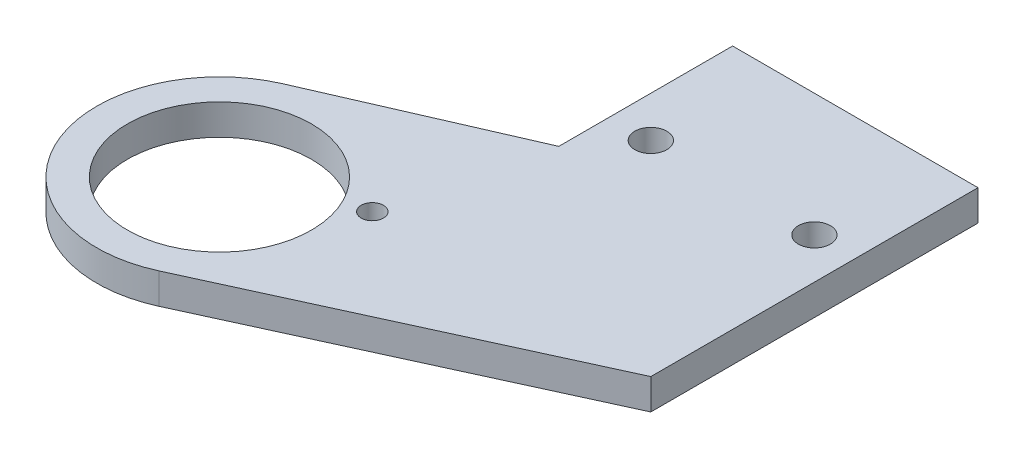
from build123d import *

# Parameters (mm, degrees)
SKETCH2_R                 = 14.2875
BOSS_EXTRUDE1_DEPTH       = 4.7625
TAP_DRILL_FOR_8_32_TAP1_D = 3.4544
F_10_CLEARANCE_HOLE1_D    = 4.9784


with BuildPart() as part:
    # Sketch2 → Boss-Extrude1 (new body)
    with BuildSketch(Plane(origin=(0, 0, 0), x_dir=(1, 0, 0), z_dir=(0, 1, 0))):
        with BuildLine():
            Line((19.05, 0), (-19.05, 0))
            Line((-19.05, 0), (-19.05, -26.9875))
            Line((-19.05, -26.9875), (-48.883968147, -39.985679272))
            ThreePointArc((-48.883968147, -39.985679272), (-58.667673568, -65.221680031), (-33.341491014, -74.769512421))
            Line((-33.341491014, -74.769512421), (19.05, -50.8))
            Line((19.05, -50.8), (19.05, 0))
        make_face()
        with Locations(Location((-41.275, -57.450103217, 0), (0, 0, 90))):
            Circle(SKETCH2_R, mode=Mode.SUBTRACT)
    extrude(amount=BOSS_EXTRUDE1_DEPTH)

    # Tap Drill for #8-32 Tap1 (through all)
    with Locations(Plane(origin=(0, 4.7625, 0), x_dir=(1, 0, 0), z_dir=(0, 1, 0))):
        with Locations((-24.742011998, -50.246946705)):
            Hole(TAP_DRILL_FOR_8_32_TAP1_D / 2)

    # #10 Clearance Hole1 (through all)
    with Locations(Plane(origin=(0, 4.7625, 0), x_dir=(1, 0, 0), z_dir=(0, 1, 0))):
        with Locations((-12.7, -19.05), (12.7, -19.05)):
            Hole(F_10_CLEARANCE_HOLE1_D / 2)


solid = part.part
